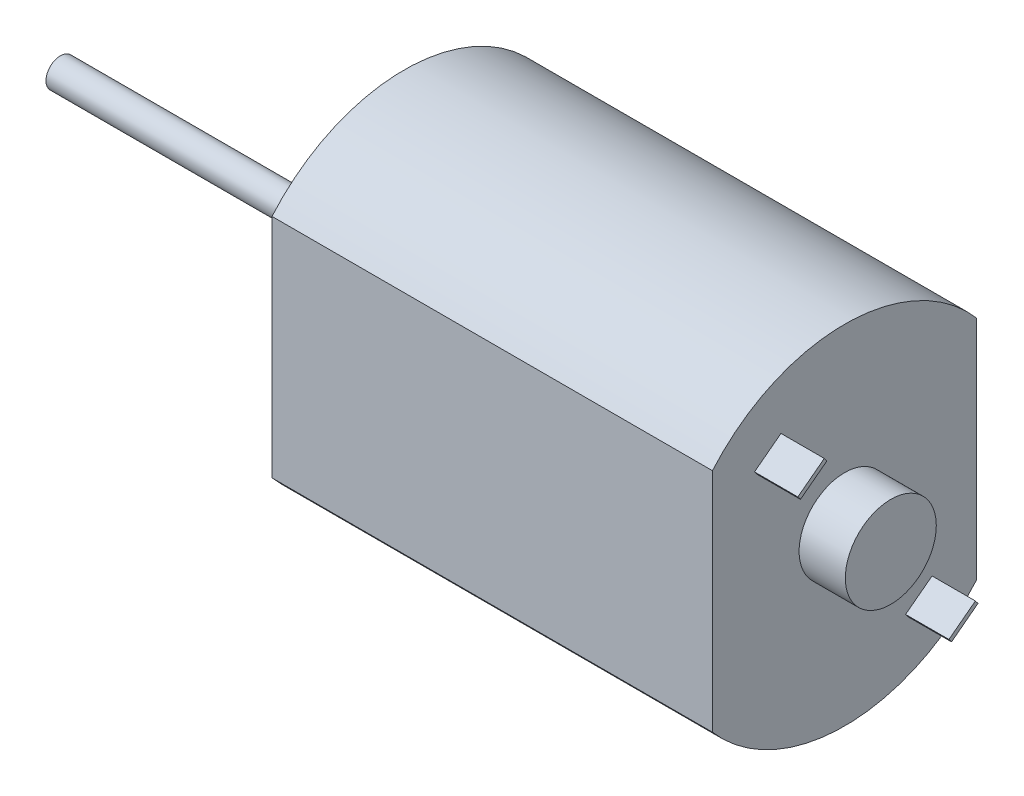
from build123d import *

# Parameters (mm, degrees)
EXTRUDE_1_DEPTH = 30.5
SKETCH_2_R      = 3.1
EXTRUDE_2_DEPTH = 1.5
EXTRUDE_START   = -1.5
SKETCH_3_R      = 1
EXTRUDE_3_DEPTH = 23.8
SKETCH_5_R      = 3.15
EXTRUDE_4_DEPTH = 3.2
EXTRUDE_5_DEPTH = 3


with BuildPart() as part:
    # 草图1 → 凸台-拉伸1 (new body)
    with BuildSketch(Plane(origin=(0, 0, 0), x_dir=(0, 0, -1), z_dir=(1, 0, 0))):
        with BuildLine():
            ThreePointArc((-9.15, -7.840918314), (-5.035843242, -10.947272849), (0, -12.05))
            ThreePointArc((0, -12.05), (5.035843242, -10.947272849), (9.15, -7.840918314))
            Line((9.15, -7.840918314), (9.15, 7.840918314))
            ThreePointArc((9.15, 7.840918314), (5.035843234, 10.947272853), (-1.8e-08, 12.05))
            ThreePointArc((-1.8e-08, 12.05), (-5.03584325, 10.947272846), (-9.15, 7.840918314))
            Line((-9.15, 7.840918314), (-9.15, -7.840918314))
        make_face()
    extrude(amount=EXTRUDE_1_DEPTH)

    # 草图2 → 凸台-拉伸2 (add)
    with BuildSketch(Plane.ZY):
        Circle(SKETCH_2_R)
    extrude(amount=EXTRUDE_2_DEPTH)

    # 草图3 → 凸台-拉伸3 (add)
    with BuildSketch(Plane.ZY.offset(1.5).offset(EXTRUDE_START)):
        with Locations(Location((0, 0, 0), (0, 0, 180))):
            Circle(SKETCH_3_R)
    extrude(amount=EXTRUDE_3_DEPTH)

    # 草图5 → 凸台-拉伸4 (add)
    with BuildSketch(Plane(origin=(30.5, 0, 0), x_dir=(0, 0, -1), z_dir=(1, 0, 0))):
        Circle(SKETCH_5_R)
    extrude(amount=EXTRUDE_4_DEPTH)

    # 草图6 → 凸台-拉伸5 (add)
    with BuildSketch(Plane(origin=(30.5, 0, 0), x_dir=(0, 0, -1), z_dir=(1, 0, 0))):
        Polygon((-6.056237864, 6.074082889), (-4.224479128, 7.465003423), (-4.405903545, 7.703928475), (-6.237662281, 6.313007941), align=None)
        Polygon((6.237662281, -6.313007941), (4.405903545, -7.703928475), (4.224479128, -7.465003423), (6.056237864, -6.074082889), align=None)
    extrude(amount=EXTRUDE_5_DEPTH)


solid = part.part
